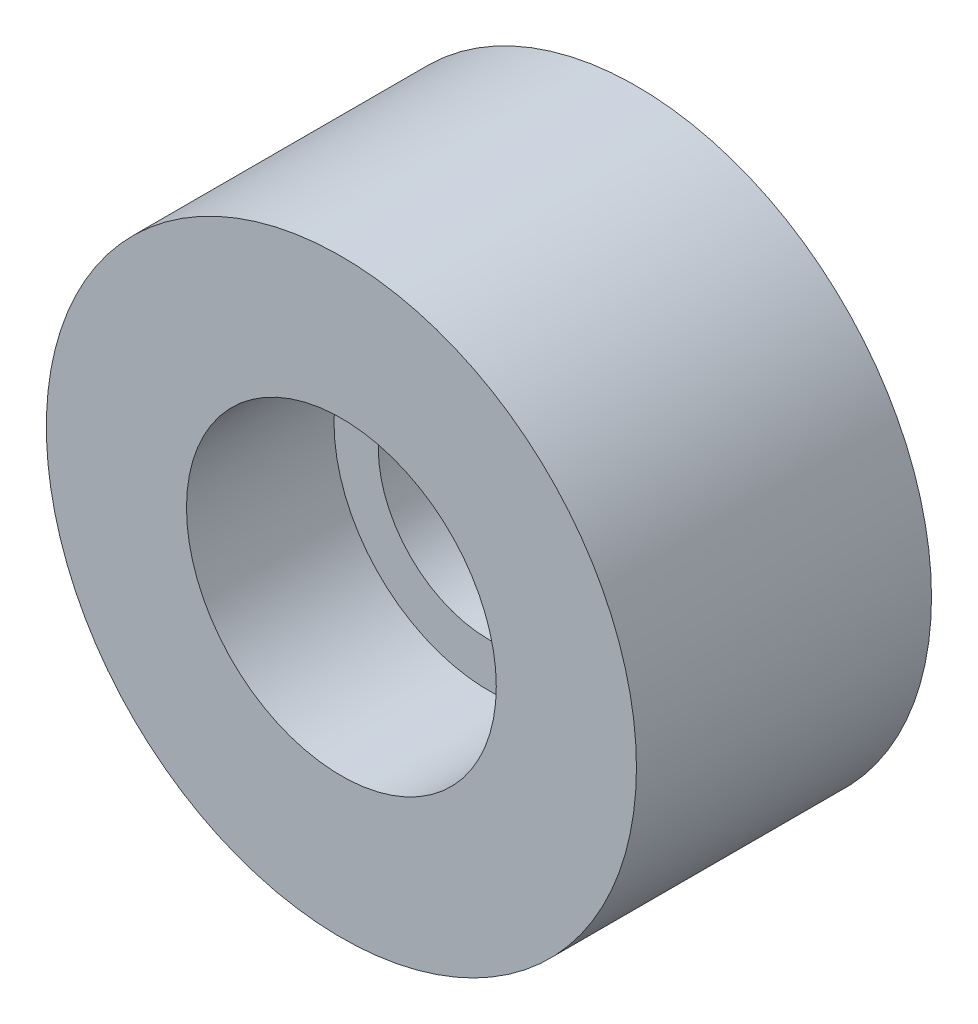
from build123d import *

# Parameters (mm, degrees)
ESQUISSE1_R             = 4
BOSS_EXTRU_1_DEPTH      = 4
ESQUISSE2_R             = 2.1
ENL_V_MAT_EXTRU_1_DEPTH = 2
ESQUISSE3_R             = 1.5
ENL_V_MAT_EXTRU_2_DEPTH = 7.92820323


with BuildPart() as part:
    # Esquisse1 → Boss.-Extru.1 (new body)
    with BuildSketch(Plane.XY):
        Circle(ESQUISSE1_R)
    extrude(amount=BOSS_EXTRU_1_DEPTH)

    # Esquisse2 → Enlèv. mat.-Extru.1 (cut)
    with BuildSketch(Plane.XY.offset(4)):
        Circle(ESQUISSE2_R)
    extrude(amount=-ENL_V_MAT_EXTRU_1_DEPTH, mode=Mode.SUBTRACT)

    # Esquisse3 → Enlèv. mat.-Extru.2 (cut, through all)
    with BuildSketch(Plane(origin=(0, 0, 0), x_dir=(-1, 0, 0), z_dir=(0, 0, -1))):
        Circle(ESQUISSE3_R)
    extrude(amount=-ENL_V_MAT_EXTRU_2_DEPTH, mode=Mode.SUBTRACT)


solid = part.part
